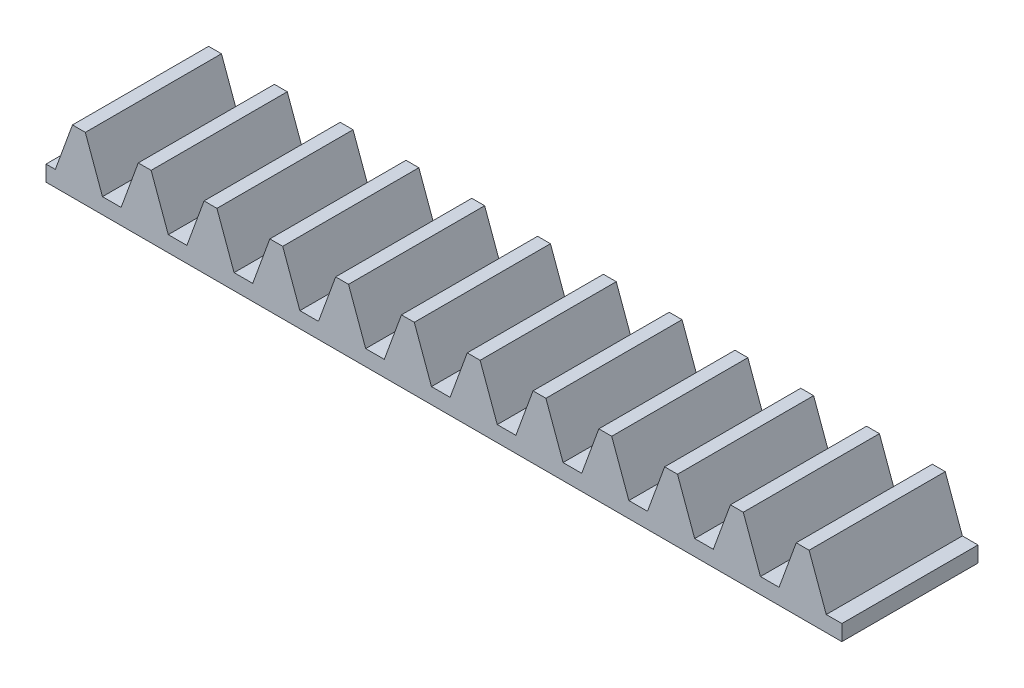
from build123d import *

# Parameters (mm, degrees)
BLANKSKE_W        = 38
BLANKSKE_H        = 3
BLANK_DEPTH       = 6.5
TOOTHCUTSIM_DEPTH = 39.668462602
TEETHCUTS_COUNT   = 14
TEETHCUTS_PITCH   = 3.14159265


with BuildPart() as part:
    # BlankSke → Blank (new body)
    with BuildSketch(Plane.XY):
        with Locations((19, 1.5)):
            Rectangle(BLANKSKE_W, BLANKSKE_H)
    extrude(amount=-BLANK_DEPTH)

    # TooCutSkeSim → ToothCutSim (cut, through all)
    with BuildSketch(Plane.XY):
        Polygon((0.44443537, 0.75), (-0.44443537, 0.75), (-1.272613241, 3.0254), (1.272613241, 3.0254), align=None)
    toothcutsim = extrude(amount=-TOOTHCUTSIM_DEPTH, mode=Mode.SUBTRACT)

    # TeethCuts: ToothCutSim ×14
    with Locations(*[(i * TEETHCUTS_PITCH, 0, 0) for i in range(1, TEETHCUTS_COUNT)]):
        add(toothcutsim, mode=Mode.SUBTRACT)


solid = part.part
